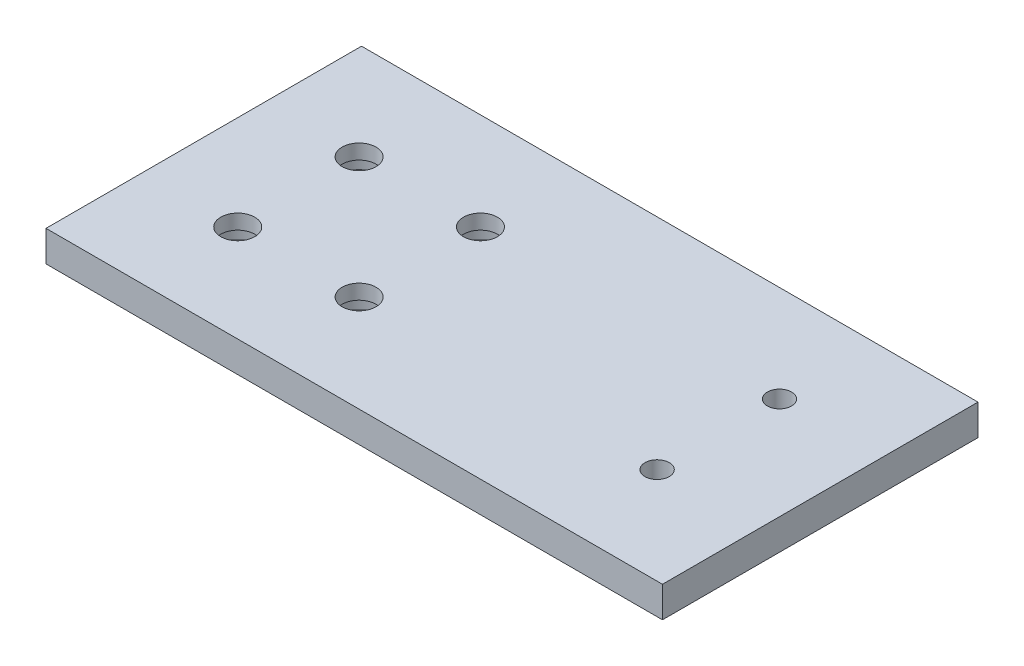
from build123d import *

# Parameters (mm, degrees)
SKETCH1_W                       = 127
SKETCH1_H                       = 65
EXTRUDE1_DEPTH                  = 6.35
M6X1_0_TAPPED_HOLE1_D           = 5
CBORE_FOR_M6_SBHCS1_D           = 7
CBORE_FOR_M6_SBHCS1_CBORE_D     = 11.5
CBORE_FOR_M6_SBHCS1_CBORE_DEPTH = 3.3


with BuildPart() as part:
    # Sketch1 → Extrude1 (new body)
    with BuildSketch(Plane(origin=(0, 0, 0), x_dir=(1, 0, 0), z_dir=(0, 1, 0))):
        Rectangle(SKETCH1_W, SKETCH1_H)
    extrude(amount=EXTRUDE1_DEPTH)

    # M6x1.0 Tapped Hole1 (through all)
    with Locations(Plane(origin=(0, 6.35, 0), x_dir=(-1, 0, 0), z_dir=(0, 1, 0))):
        with Locations((-42.5, -12.6), (-42.5, 12.6)):
            Hole(M6X1_0_TAPPED_HOLE1_D / 2)

    # CBORE for M6 SBHCS1 (through all)
    with Locations(Plane.XZ):
        with Locations((-44, 12.5), (-19, 12.5), (-19, -12.5), (-44, -12.5)):
            CounterBoreHole(CBORE_FOR_M6_SBHCS1_D / 2, CBORE_FOR_M6_SBHCS1_CBORE_D / 2, CBORE_FOR_M6_SBHCS1_CBORE_DEPTH)


solid = part.part
